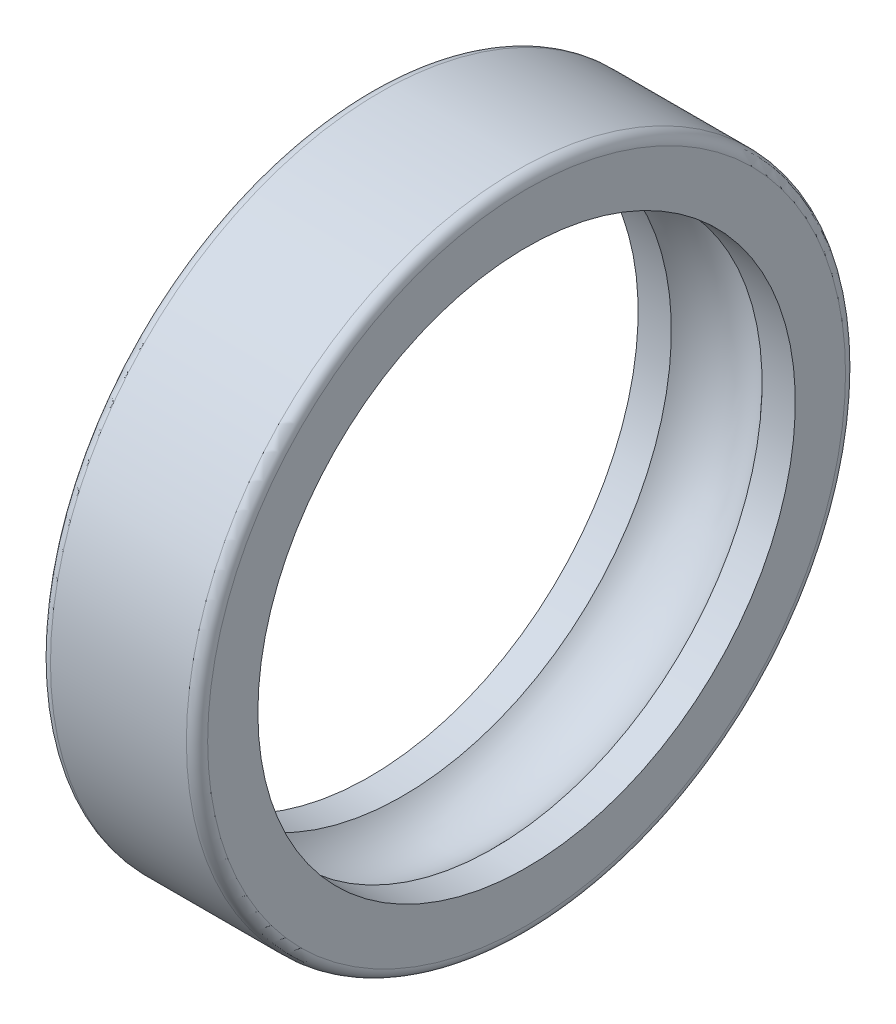
from build123d import *

# Parameters (mm, degrees)
FILLET1_R = 2.1


with BuildPart() as part:
    # Sketch1 → Revolve2 (revolve)
    with BuildSketch(Plane.XY, mode=Mode.PRIVATE) as revolve2_sk:
        with BuildLine():
            Line((15.5, 65), (-15.5, 65))
            Line((-15.5, 65), (-15.5, 53))
            Line((-15.5, 53), (-8.94427191, 53))
            ThreePointArc((-8.94427191, 53), (0, 57), (8.94427191, 53))
            Line((8.94427191, 53), (15.5, 53))
            Line((15.5, 53), (15.5, 65))
        make_face()
    revolve(revolve2_sk.sketch.rotate(Axis((-8.063583815, 0, 0), (1, 0, 0)), 90), axis=Axis((-8.063583815, 0, 0), (1, 0, 0)))

    # Fillet1
    fillet1_edges = [part.edges().sort_by_distance(p)[0] for p in [
        (-15.5, 0, -65),
        (15.5, 0, -65),
    ]]
    fillet(fillet1_edges, radius=FILLET1_R)


solid = part.part
